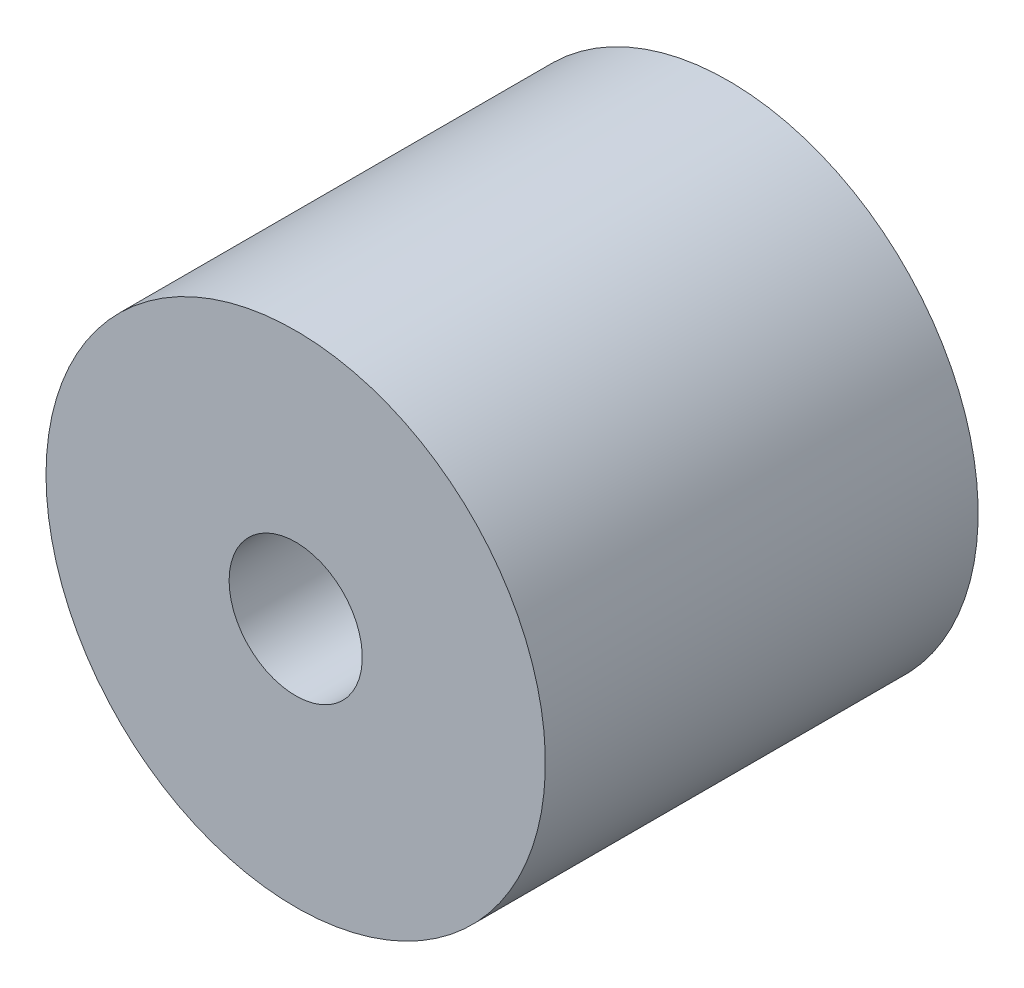
from build123d import *

# Parameters (mm, degrees)
SKETCH1_R           = 15
SKETCH1_R_2         = 4
BOSS_EXTRUDE1_DEPTH = 26


with BuildPart() as part:
    # Sketch1 → Boss-Extrude1 (new body)
    with BuildSketch(Plane.XY):
        with Locations(Location((0, 0, 0), (0, 0, 180))):
            Circle(SKETCH1_R)
        with Locations(Location((0, 0, 0), (0, 0, 180))):
            Circle(SKETCH1_R_2, mode=Mode.SUBTRACT)
    extrude(amount=BOSS_EXTRUDE1_DEPTH)


solid = part.part
